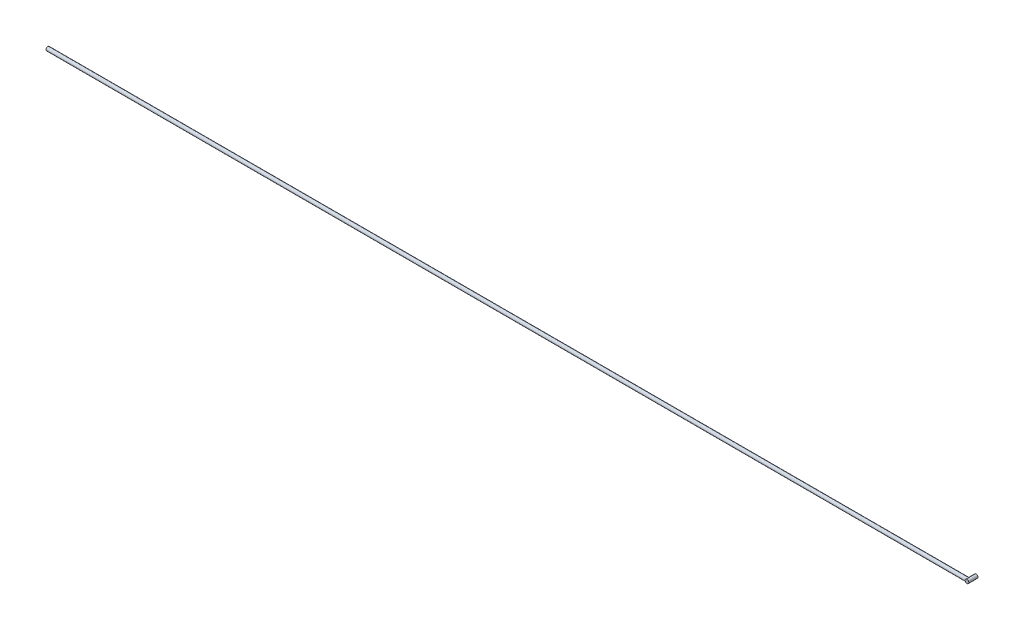
from build123d import *

# Parameters (mm, degrees)
BALAYAGE1_PROFILE_R = 1
BALAYAGE2_PROFILE_R = 1


with BuildPart() as part:
    # Balayage1: sweep along a path in Esquisse1
    with BuildLine(Plane.XY) as balayage1_path:
        Line((-250, 0), (250, 0))
    # Balayage1 profile (on start of the path) → Balayage1 (sweep)
    with BuildSketch(Plane(origin=(-250, 0, 0), x_dir=(0, 0, 1), z_dir=(1, 0, 0))):
        Circle(BALAYAGE1_PROFILE_R)
    sweep(path=balayage1_path.line)

    # Balayage2: sweep along a path in Esquisse16
    with BuildLine(Plane(origin=(250, 0, 0), x_dir=(0, 0, -1), z_dir=(1, 0, 0))) as balayage2_path:
        Line((-1, 0), (4, 0))
    # Balayage2 profile (on start of the path) → Balayage2 (sweep)
    with BuildSketch(Plane(origin=(250, 0, 1), x_dir=(-1, 0, 0), z_dir=(0, 0, -1))):
        Circle(BALAYAGE2_PROFILE_R)
    sweep(path=balayage2_path.line)


solid = part.part
